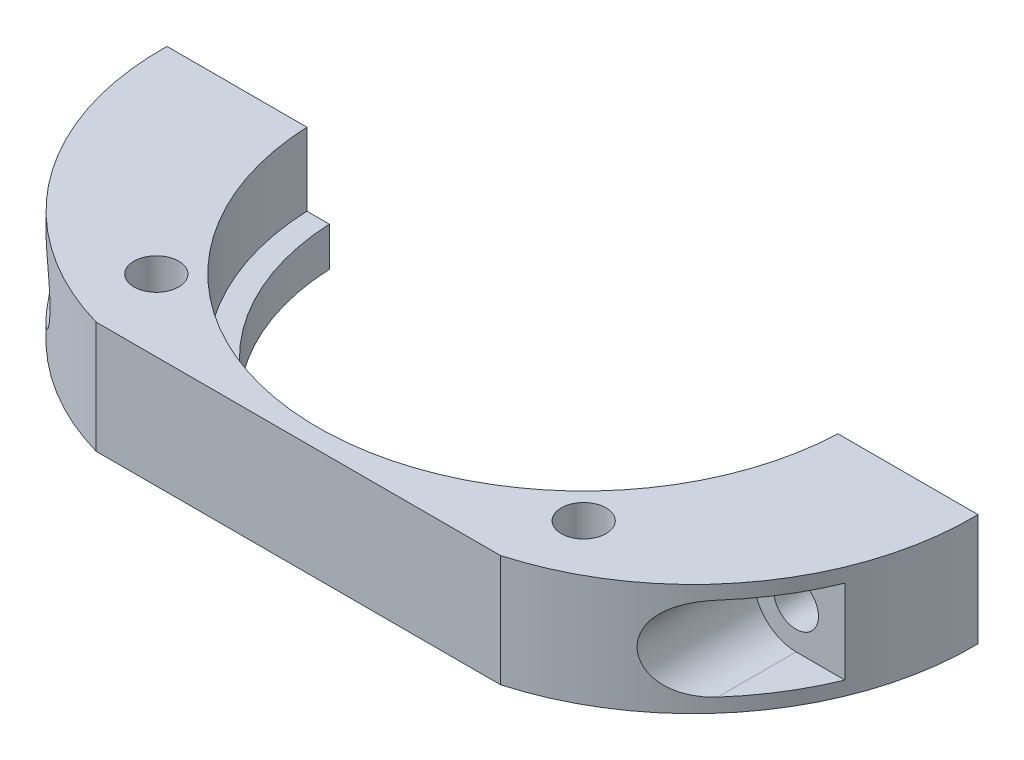
from build123d import *

# Parameters (mm, degrees)
SKETCH1_R           = 62.5
SKETCH1_R_2         = 43.5
BOSS_EXTRUDE1_DEPTH = 20
SKETCH2_R           = 47.5
CUT_EXTRUDE1_DEPTH  = 13
SKETCH3_R           = 4
CUT_EXTRUDE2_DEPTH  = 91.622844802
SKETCH4_W           = 150
SKETCH4_H           = 64.5
SKETCH4_W_2         = 72.256487598
SKETCH4_H_2         = 11.5
CUT_EXTRUDE3_DEPTH  = 91.622844802
BOSS_EXTRUDE4_DEPTH = 20
SKETCH7_R           = 4
CUT_EXTRUDE4_DEPTH  = 90.742875716
SKETCH8_R           = 4
CUT_EXTRUDE5_DEPTH  = 90.742875874
CUT_EXTRUDE6_START  = -20
SKETCH12_W          = 2.494942127
SKETCH12_H          = 15
SKETCH12_R          = 7.5
SKETCH12_R_2        = 4
CUT_EXTRUDE6_DEPTH  = 70.742875874


with BuildPart() as part:
    # Sketch1 → Boss-Extrude1 (new body)
    with BuildSketch(Plane(origin=(0, 0, 0), x_dir=(1, 0, 0), z_dir=(0, 1, 0))):
        with Locations(Location((0, 0, 0), (0, 0, 270))):
            Circle(SKETCH1_R)
        with Locations(Location((0, 0, 0), (0, 0, 270))):
            Circle(SKETCH1_R_2, mode=Mode.SUBTRACT)
    extrude(amount=BOSS_EXTRUDE1_DEPTH)

    # Sketch2 → Cut-Extrude1 (cut)
    with BuildSketch(Plane(origin=(0, 20, 0), x_dir=(1, 0, 0), z_dir=(0, 1, 0))):
        with Locations(Location((0, 0, 0), (0, 0, 270))):
            Circle(SKETCH2_R)
    extrude(amount=-CUT_EXTRUDE1_DEPTH, mode=Mode.SUBTRACT)

    # Sketch3 → Cut-Extrude2 (cut, through all)
    with BuildSketch(Plane(origin=(0, 20, 0), x_dir=(1, 0, 0), z_dir=(0, 1, 0))):
        with Locations(Location((38.183766184, 38.183766184, 0), (0, 0, 270))):
            Circle(SKETCH3_R)
        with Locations(Location((38.183766184, -38.183766184, 0), (0, 0, 270))):
            Circle(SKETCH3_R)
        with Locations(Location((-38.183766184, -38.183766184, 0), (0, 0, 270))):
            Circle(SKETCH3_R)
        with Locations(Location((-38.183766184, 38.183766184, 0), (0, 0, 270))):
            Circle(SKETCH3_R)
    extrude(amount=-CUT_EXTRUDE2_DEPTH, mode=Mode.SUBTRACT)

    # Sketch4 → Cut-Extrude3 (cut, through all)
    with BuildSketch(Plane(origin=(0, 20, 0), x_dir=(1, 0, 0), z_dir=(0, 1, 0))):
        with Locations((0, 30.25)):
            Rectangle(SKETCH4_W, SKETCH4_H)
        with Locations((0, -56.75)):
            Rectangle(SKETCH4_W_2, SKETCH4_H_2)
    extrude(amount=-CUT_EXTRUDE3_DEPTH, mode=Mode.SUBTRACT)

    # Sketch6 → Boss-Extrude4 (add, through all)
    with BuildSketch(Plane(origin=(0, 20, 0), x_dir=(1, 0, 0), z_dir=(0, 1, 0))):
        with BuildLine():
            Line((-62.467991804, -2), (-72.467991804, -2))
            ThreePointArc((-72.467991804, -2), (-62.636910051, -32.684277735), (-36.128243799, -51))
            ThreePointArc((-36.128243799, -51), (-55.050471558, -29.592154049), (-62.467991804, -2))
        make_face()
        with BuildLine():
            ThreePointArc((62.467991804, -2), (55.050471558, -29.592154049), (36.128243799, -51))
            ThreePointArc((36.128243799, -51), (62.636910051, -32.684277735), (72.467991804, -2))
            Line((72.467991804, -2), (62.467991804, -2))
        make_face()
    extrude(amount=-BOSS_EXTRUDE4_DEPTH)

    # Sketch7 → Cut-Extrude4 (cut, through all)
    with BuildSketch(Plane(origin=(0, 0, 2), x_dir=(-1, 0, 0), z_dir=(0, 0, -1))):
        with Locations((-59.962933931, 10)):
            Circle(SKETCH7_R)
    extrude(amount=-CUT_EXTRUDE4_DEPTH, mode=Mode.SUBTRACT)

    # Sketch8 → Cut-Extrude5 (cut, through all)
    with BuildSketch(Plane(origin=(0, 0, 2), x_dir=(-1, 0, 0), z_dir=(0, 0, -1))):
        with Locations((59.962933931, 10)):
            Circle(SKETCH8_R)
    extrude(amount=-CUT_EXTRUDE5_DEPTH, mode=Mode.SUBTRACT)

    # Sketch12 → Cut-Extrude6 (cut, through all)
    # profile 1 of 3: a face of its own
    with BuildSketch(Plane(origin=(0, 0, 2), x_dir=(-1, 0, 0), z_dir=(0, 0, -1)).offset(CUT_EXTRUDE6_START)):
        with Locations((73.715462868, 10)):
            Rectangle(SKETCH12_W, SKETCH12_H)
    # profile 2 of 3: a face of its own
    with BuildSketch(Plane(origin=(0, 0, 2), x_dir=(-1, 0, 0), z_dir=(0, 0, -1)).offset(CUT_EXTRUDE6_START)):
        with Locations((59.962933931, 10)):
            Circle(SKETCH12_R)
        with Locations((59.962933931, 10)):
            Circle(SKETCH12_R_2, mode=Mode.SUBTRACT)
    # profile 3 of 3: a face of its own
    with BuildSketch(Plane(origin=(0, 0, 2), x_dir=(-1, 0, 0), z_dir=(0, 0, -1)).offset(CUT_EXTRUDE6_START)):
        with BuildLine():
            Line((59.962933931, 2.5), (72.467991804, 2.5))
            Line((72.467991804, 2.5), (72.467991804, 17.5))
            Line((72.467991804, 17.5), (59.962933931, 17.5))
            ThreePointArc((59.962933931, 17.5), (65.26623479, 15.303300859), (67.462933931, 10))
            ThreePointArc((67.462933931, 10), (65.26623479, 4.696699141), (59.962933931, 2.5))
        make_face()
    cut_extrude6 = extrude(amount=-CUT_EXTRUDE6_DEPTH, mode=Mode.SUBTRACT)

    # Mirror1: Cut-Extrude6 across plane
    add(cut_extrude6.mirror(Plane(origin=(0, 0, 0), x_dir=(0, 0, 1), z_dir=(1, 0, 0))), mode=Mode.SUBTRACT)


solid = part.part
